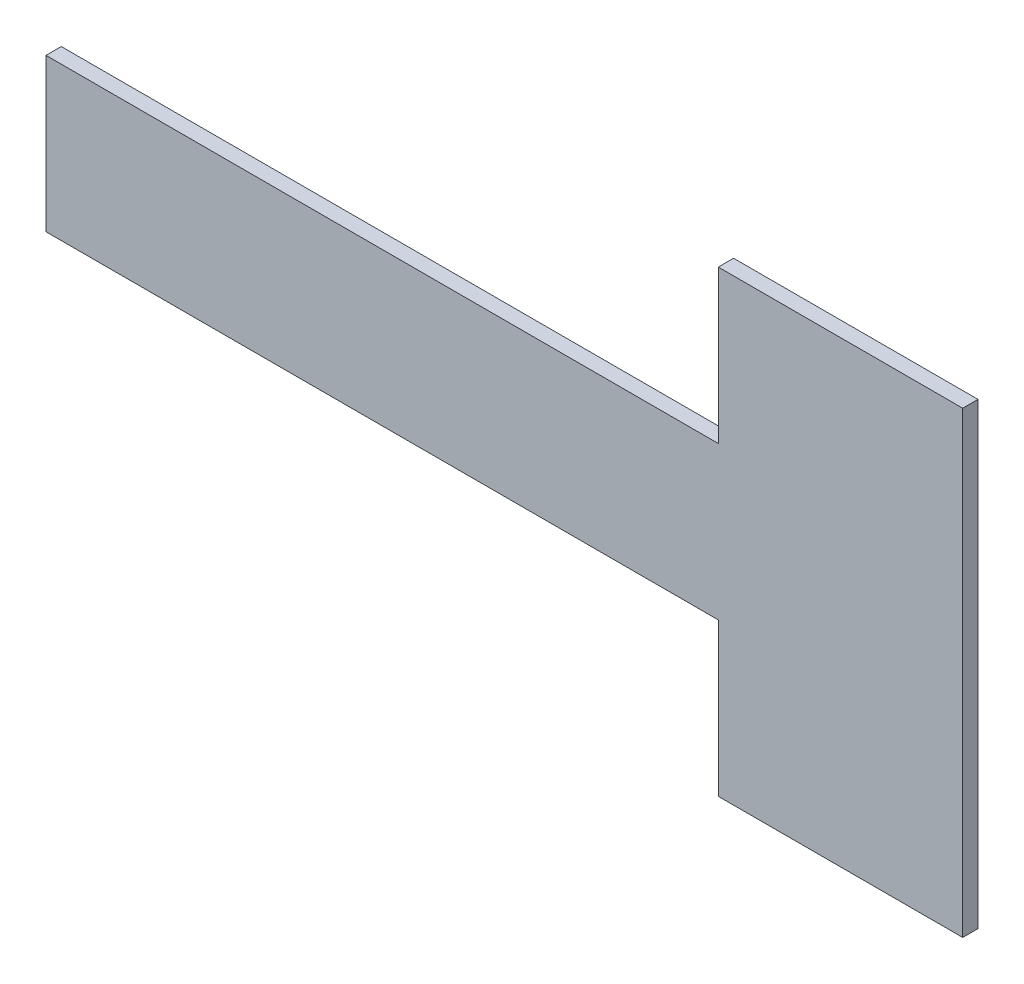
from build123d import *

# Parameters (mm, degrees)
SKETCH1_W           = 76.2
SKETCH1_H           = 12.7
BOSS_EXTRUDE1_DEPTH = 1.27
SKETCH2_W           = 20.32
SKETCH2_H           = 12.7
BOSS_EXTRUDE4_DEPTH = 1.27


with BuildPart() as part:
    # Sketch1 → Boss-Extrude1 (new body)
    with BuildSketch(Plane.XY):
        with Locations((38.1, -6.35)):
            Rectangle(SKETCH1_W, SKETCH1_H)
    extrude(amount=BOSS_EXTRUDE1_DEPTH)

    # Sketch2 → Boss-Extrude4 (add)
    with BuildSketch(Plane(origin=(0, 0, 0), x_dir=(-1, 0, 0), z_dir=(0, 0, -1))):
        with Locations((-66.04, 6.35)):
            Rectangle(SKETCH2_W, SKETCH2_H)
        with Locations((-66.04, -19.05)):
            Rectangle(SKETCH2_W, SKETCH2_H)
    extrude(amount=-BOSS_EXTRUDE4_DEPTH)


solid = part.part
